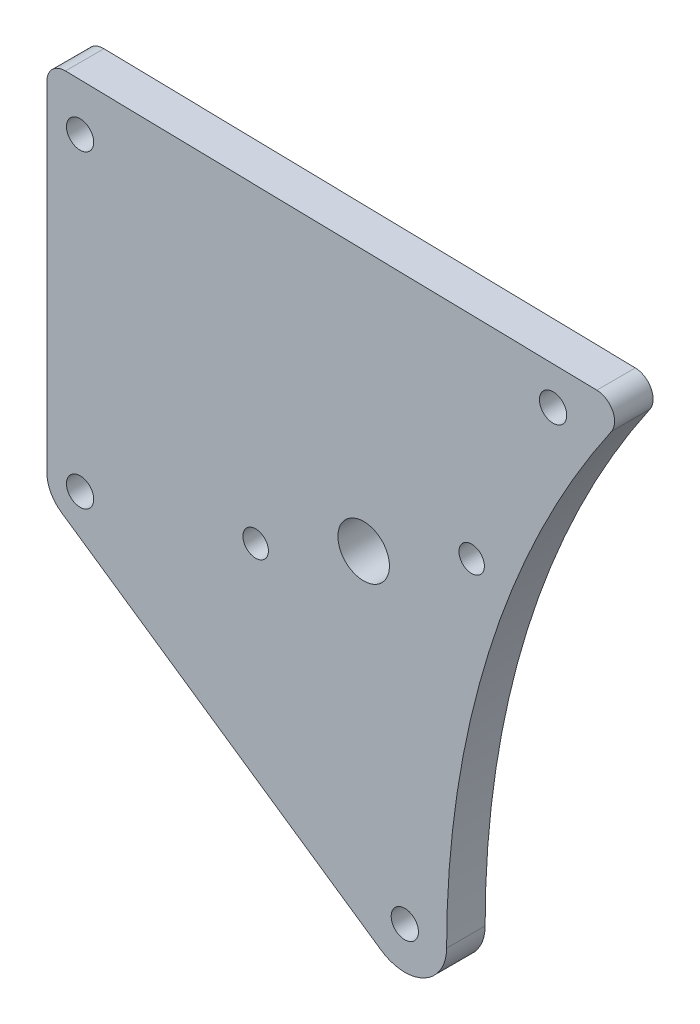
from build123d import *

# Parameters (mm, degrees)
SKETCH1_R           = 2.1
SKETCH1_R_2         = 4.248828393
SKETCH1_R_3         = 2.248
BOSS_EXTRUDE1_DEPTH = 6.35


with BuildPart() as part:
    # Sketch1 → Boss-Extrude1 (new body)
    with BuildSketch(Plane.XY):
        with BuildLine():
            Line((-164.857630571, -5.684506245), (-217.606823936, 30.483431618))
            ThreePointArc((-217.606823936, 30.483431618), (-219.355038804, 32.447489975), (-219.986286008, 35))
            Line((-219.986286008, 35), (-219.986286008, 90.85821565))
            ThreePointArc((-219.986286008, 90.85821565), (-219.086022557, 93.00090238), (-216.925548391, 93.857600744))
            Line((-216.925548391, 93.857600744), (-129.300414508, 92.083189784))
            ThreePointArc((-129.300414508, 92.083189784), (-126.69155089, 90.452464344), (-126.890346887, 87.38229904))
            ThreePointArc((-126.890346887, 87.38229904), (-147.116480921, 45.755517262), (-154.067603079, 0))
            ThreePointArc((-154.067603079, 0), (-157.747437287, -6.09791572), (-164.857630571, -5.684506245))
        make_face()
        with Locations((-185.554258914, 42.046855659)):
            Circle(SKETCH1_R, mode=Mode.SUBTRACT)
        with Locations((-149.938627555, 57.675374206)):
            Circle(SKETCH1_R, mode=Mode.SUBTRACT)
        with Locations((-167.746443234, 49.861114932)):
            Circle(SKETCH1_R_2, mode=Mode.SUBTRACT)
        with Locations((-214.51, 86)):
            Circle(SKETCH1_R_3, mode=Mode.SUBTRACT)
        with Locations((-214.51, 35)):
            Circle(SKETCH1_R_3, mode=Mode.SUBTRACT)
        with Locations((-136.51, 86)):
            Circle(SKETCH1_R_3, mode=Mode.SUBTRACT)
        with Locations((-160.96, 0)):
            Circle(SKETCH1_R_3, mode=Mode.SUBTRACT)
    extrude(amount=BOSS_EXTRUDE1_DEPTH)


solid = part.part
